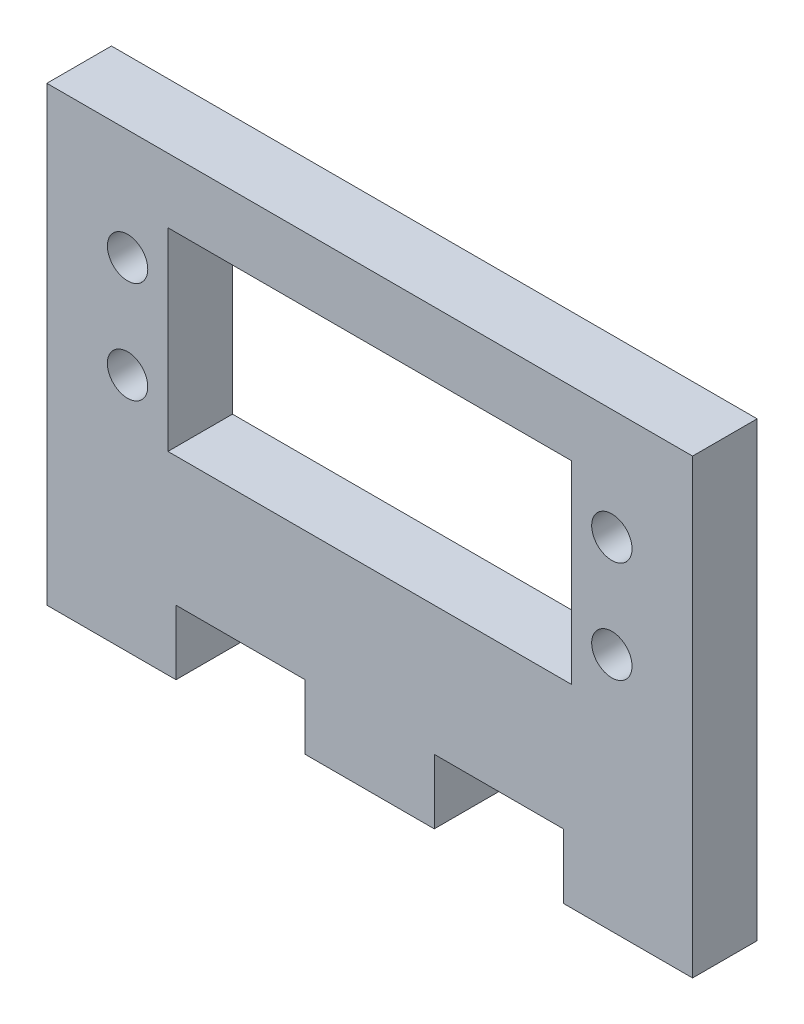
from build123d import *

# Parameters (mm, degrees)
SKETCH2_R           = 1.984375
SKETCH2_W           = 39.6875
SKETCH2_H           = 19.05
BOSS_EXTRUDE1_DEPTH = 6.35


with BuildPart() as part:
    # Sketch2 → Boss-Extrude1 (new body)
    with BuildSketch(Plane.XY):
        Polygon((51.59375, 25.4), (-11.90625, 25.4), (-11.90625, -19.05), (0.79375, -19.05), (0.79375, -12.7), (13.49375, -12.7), (13.49375, -19.05), (26.19375, -19.05), (26.19375, -12.7), (38.89375, -12.7), (38.89375, -19.05), (51.59375, -19.05), align=None)
        with Locations((-3.96875, 4.525)):
            Circle(SKETCH2_R, mode=Mode.SUBTRACT)
        with Locations((-3.96875, 14.525)):
            Circle(SKETCH2_R, mode=Mode.SUBTRACT)
        with Locations((19.84375, 9.525)):
            Rectangle(SKETCH2_W, SKETCH2_H, mode=Mode.SUBTRACT)
        with Locations((43.65625, 4.525)):
            Circle(SKETCH2_R, mode=Mode.SUBTRACT)
        with Locations((43.65625, 14.525)):
            Circle(SKETCH2_R, mode=Mode.SUBTRACT)
    extrude(amount=BOSS_EXTRUDE1_DEPTH)


solid = part.part
